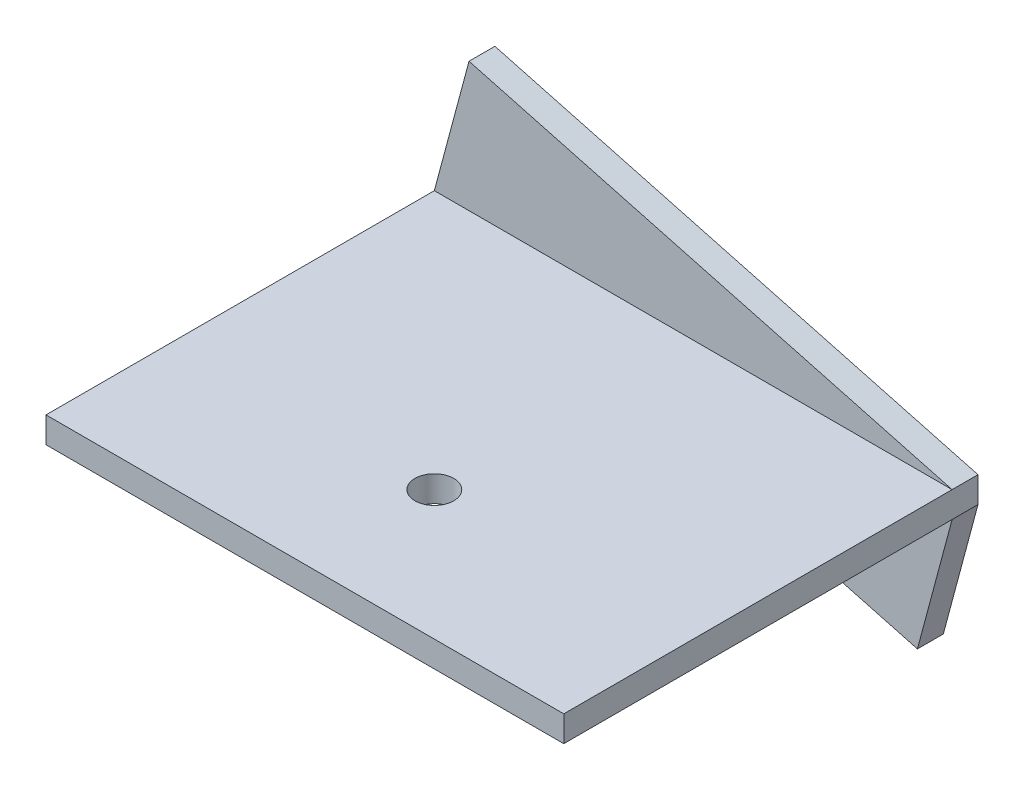
from build123d import *

# Parameters (mm, degrees)
SKETCH1_W           = 80
SKETCH1_H           = 60
BOSS_EXTRUDE1_DEPTH = 4
SKETCH2_R           = 3
CUT_EXTRUDE1_DEPTH  = 4
BOSS_EXTRUDE4_DEPTH = 4
SKETCH9_W           = 80
SKETCH9_H           = 4
BOSS_EXTRUDE5_DEPTH = 54
CUT_EXTRUDE5_DEPTH  = 54
CUT_EXTRUDE6_DEPTH  = 54
CUT_EXTRUDE7_DEPTH  = 54


with BuildPart() as part:
    # Sketch1 → Boss-Extrude1 (new body)
    with BuildSketch(Plane(origin=(0, 0, 0), x_dir=(1, 0, 0), z_dir=(0, 1, 0))):
        Rectangle(SKETCH1_W, SKETCH1_H)
    extrude(amount=BOSS_EXTRUDE1_DEPTH)

    # Sketch2 → Cut-Extrude1 (cut)
    with BuildSketch(Plane(origin=(0, 4, 0), x_dir=(1, 0, 0), z_dir=(0, 1, 0))):
        with Locations(Location((0, -10, 0), (0, 0, 270))):
            Circle(SKETCH2_R)
    extrude(amount=-CUT_EXTRUDE1_DEPTH, mode=Mode.SUBTRACT)



with BuildPart() as body_2:
    # Sketch8 → Boss-Extrude4 (new body)
    with BuildSketch(Plane(origin=(0, 0, -30), x_dir=(-1, 0, 0), z_dir=(0, 0, -1))):
        with BuildLine():
            Line((-40, 4), (37.274066103, 24.705523608))
            ThreePointArc((37.274066103, 24.705523608), (39.31558891, 14.442095378), (40, 4))
            Line((40, 4), (-40, 4))
        make_face()
    extrude(amount=BOSS_EXTRUDE4_DEPTH)


with BuildPart() as part_1:
    add(part.part)

    add(body_2.part)  # Boss-Extrude5 merges body 2
    # Sketch9 → Boss-Extrude5 (add)
    with BuildSketch(Plane.XZ.offset(-4)):
        with Locations((0, -32)):
            Rectangle(SKETCH9_W, SKETCH9_H)
    extrude(amount=BOSS_EXTRUDE5_DEPTH)

    # Sketch10 → Cut-Extrude5 (cut)
    with BuildSketch(Plane.XY.offset(-30)):
        Polygon((-40, 4), (-34.641016151, 24), (-48.042949513, 27.591037221), align=None)
    extrude(amount=-CUT_EXTRUDE5_DEPTH, mode=Mode.SUBTRACT)

    # Sketch11 → Cut-Extrude6 (cut)
    with BuildSketch(Plane.XY.offset(-30)):
        Polygon((40, 0), (26.602540378, -50), (60.406284328, -52.474789136), align=None)
    extrude(amount=-CUT_EXTRUDE6_DEPTH, mode=Mode.SUBTRACT)

    # Sketch12 → Cut-Extrude7 (cut)
    with BuildSketch(Plane.XY.offset(-30)):
        Polygon((-40, 0), (34.641016151, -20), (30.373618341, -54.228709826), (-68.422743557, -51.185946857), align=None)
    extrude(amount=-CUT_EXTRUDE7_DEPTH, mode=Mode.SUBTRACT)


solid = part_1.part
